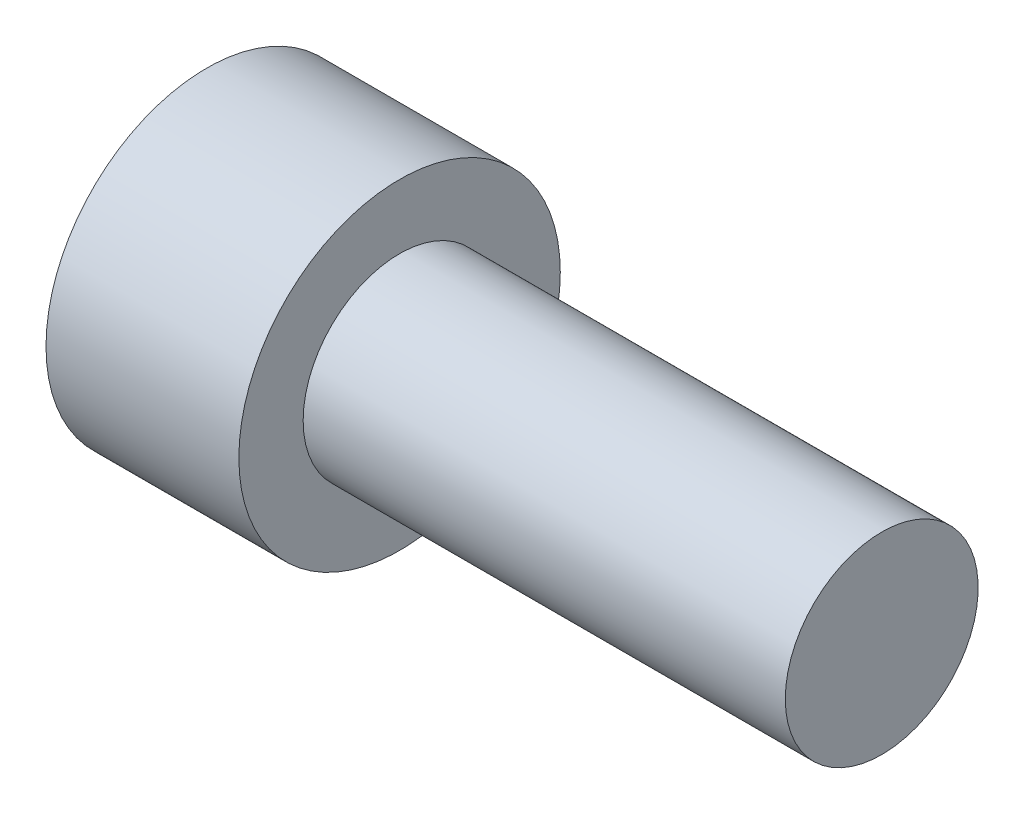
from build123d import *

# Parameters (mm, degrees)
CUT_EXTRUDE1_DEPTH = 3


with BuildPart() as part:
    # Sketch1 → Revolve1 (revolve)
    with BuildSketch(Plane.XY, mode=Mode.PRIVATE) as revolve1_sk:
        Polygon((0, 0), (0, 5), (6, 5), (6, 3), (21, 3), (21, 0), align=None)
    revolve(revolve1_sk.sketch.rotate(Axis((0, 0, 0), (1, 0, 0)), 90), axis=Axis((0, 0, 0), (1, 0, 0)))

    # Sketch2 → Cut-Revolve1 (revolve, cut)
    with BuildSketch(Plane.XY, mode=Mode.PRIVATE) as cut_revolve1_sk:
        Polygon((0, 2.5), (3, 2.5), (4.443375673, 0), (0, 0), align=None)
    revolve(cut_revolve1_sk.sketch.rotate(Axis((0, 0, 0), (1, 0, 0)), 180), axis=Axis((0, 0, 0), (1, 0, 0)), mode=Mode.SUBTRACT)

    # Sketch3 → Cut-Extrude1 (cut)
    with BuildSketch(Plane.ZY):
        Polygon((0, -2.886751346), (2.5, -1.443375673), (2.5, 1.443375673), (0, 2.886751346), (-2.5, 1.443375673), (-2.5, -1.443375673), align=None)
    extrude(amount=-CUT_EXTRUDE1_DEPTH, mode=Mode.SUBTRACT)


solid = part.part
